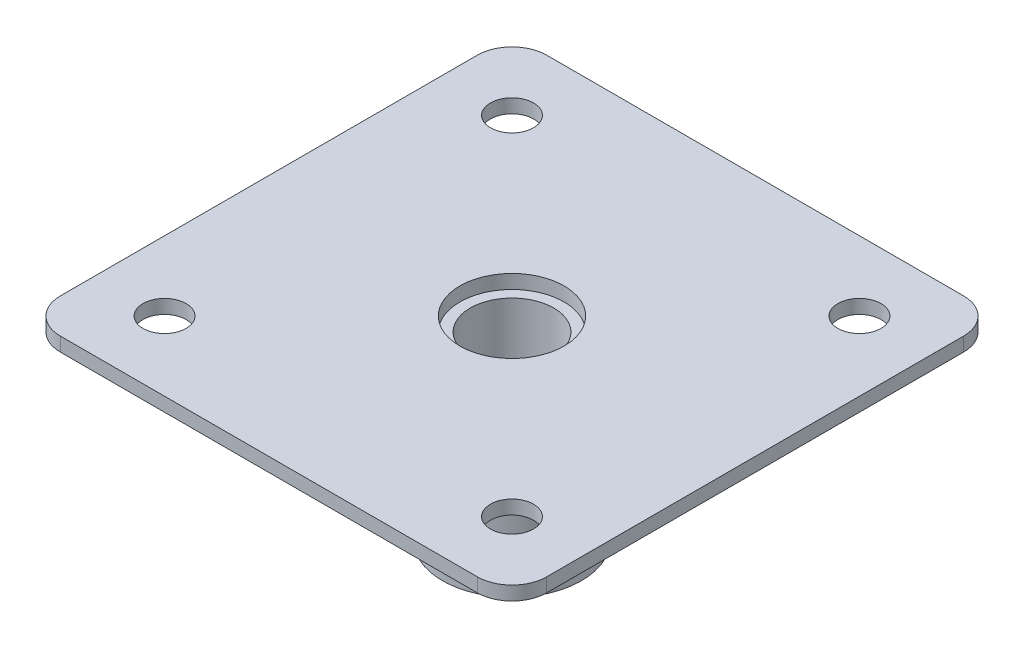
from build123d import *

# Parameters (mm, degrees)
SKETCH1_W           = 70
SKETCH1_H           = 70
SKETCH1_R           = 3.1
BOSS_EXTRUDE1_DEPTH = 2
FILLET1_R           = 5
SKETCH2_R           = 10
BOSS_EXTRUDE2_DEPTH = 26
SKETCH5_R           = 6
CUT_EXTRUDE1_DEPTH  = 57.868268832
SKETCH6_R           = 7.5
CUT_EXTRUDE2_DEPTH  = 2


with BuildPart() as part:
    # Sketch1 → Boss-Extrude1 (new body)
    with BuildSketch(Plane(origin=(0, 0, 0), x_dir=(1, 0, 0), z_dir=(0, 1, 0))):
        Rectangle(SKETCH1_W, SKETCH1_H)
        with Locations((25, 25)):
            Circle(SKETCH1_R, mode=Mode.SUBTRACT)
        with Locations((-25, -25)):
            Circle(SKETCH1_R, mode=Mode.SUBTRACT)
        with Locations((-25, 25)):
            Circle(SKETCH1_R, mode=Mode.SUBTRACT)
        with Locations((25, -25)):
            Circle(SKETCH1_R, mode=Mode.SUBTRACT)
    extrude(amount=BOSS_EXTRUDE1_DEPTH)

    # Fillet1
    fillet1_edges = [part.edges().sort_by_distance(p)[0] for p in [
        (35, 1, -35),
        (-35, 1, -35),
        (-35, 1, 35),
        (35, 1, 35),
    ]]
    fillet(fillet1_edges, radius=FILLET1_R)

    # Sketch2 → Boss-Extrude2 (add)
    with BuildSketch(Plane.XZ):
        Circle(SKETCH2_R)
    extrude(amount=BOSS_EXTRUDE2_DEPTH)

    # Sketch5 → Cut-Extrude1 (cut, through all)
    with BuildSketch(Plane.XZ.offset(26)):
        Circle(SKETCH5_R)
    extrude(amount=-CUT_EXTRUDE1_DEPTH, mode=Mode.SUBTRACT)

    # Sketch6 → Cut-Extrude2 (cut)
    with BuildSketch(Plane(origin=(0, 2, 0), x_dir=(1, 0, 0), z_dir=(0, 1, 0))):
        Circle(SKETCH6_R)
    extrude(amount=-CUT_EXTRUDE2_DEPTH, mode=Mode.SUBTRACT)


solid = part.part
